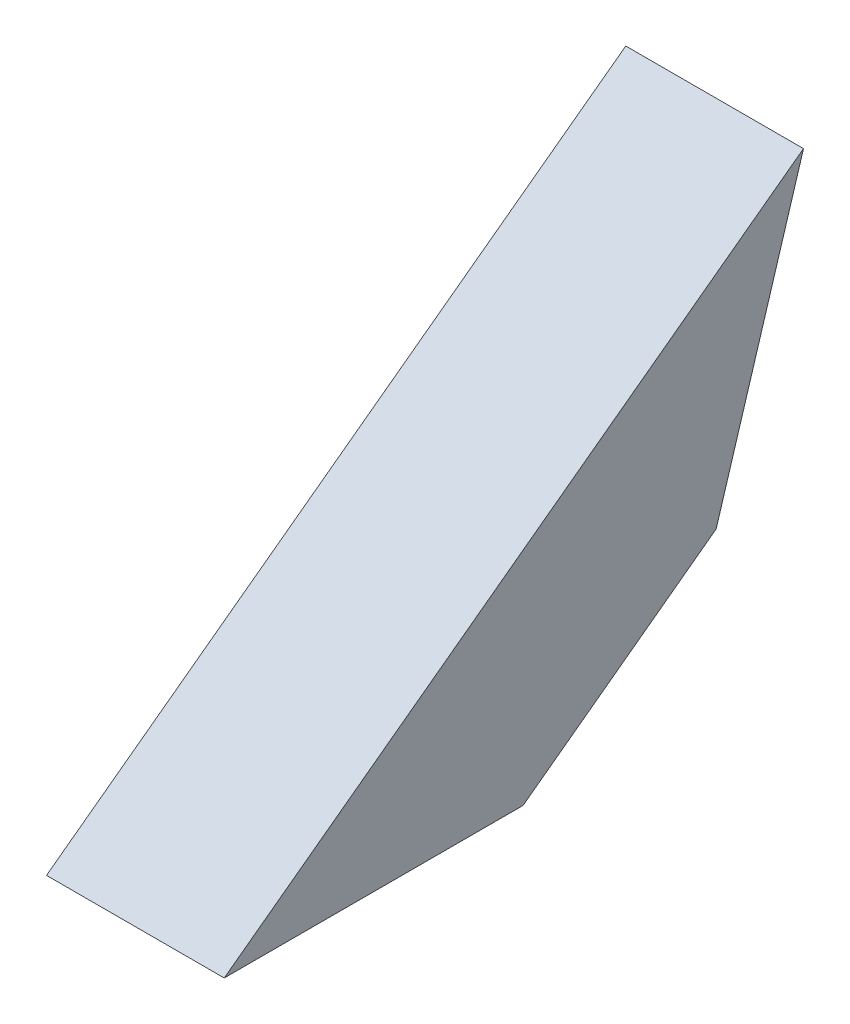
from build123d import *

# Parameters (mm, degrees)
BOSS_EXTRUDE1_DEPTH = 10


with BuildPart() as part:
    # Sketch1 → Boss-Extrude1 (new body)
    with BuildSketch(Plane(origin=(0, 0, 0), x_dir=(0, 0, -1), z_dir=(1, 0, 0))):
        Polygon((-16.811729851, 0), (0, 0), (10.863501983, 8.038568606), (15.778776099, 24.115705819), align=None)
    extrude(amount=BOSS_EXTRUDE1_DEPTH)


solid = part.part
